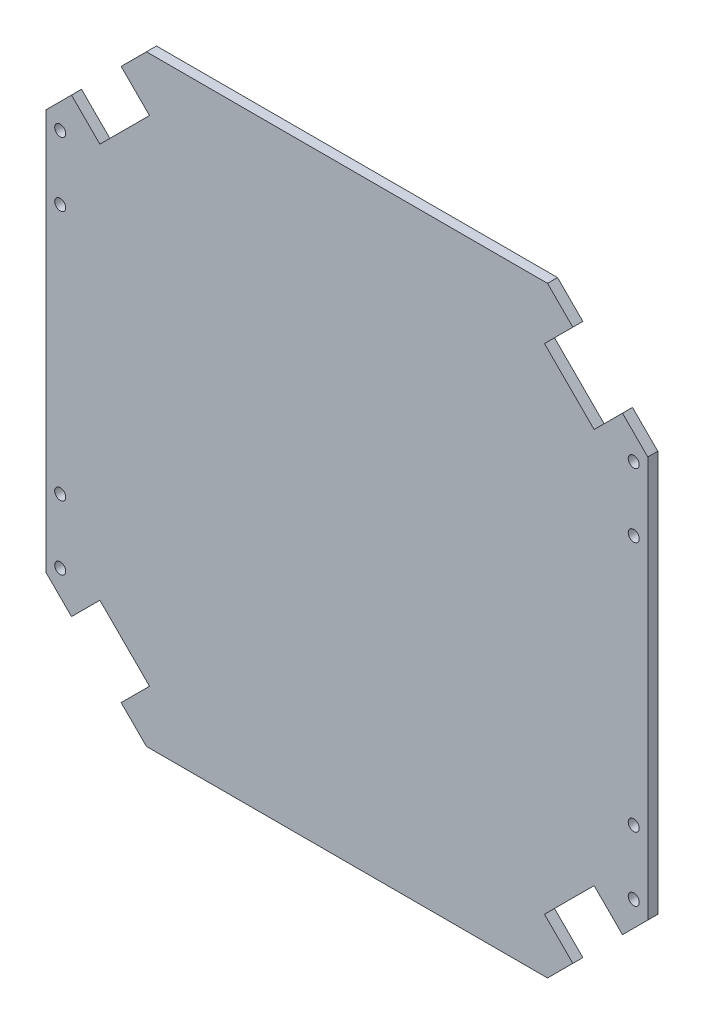
from build123d import *

# Parameters (mm, degrees)
BOSS_EXTRU_1_DEPTH      = 5
ESQUISSE2_R             = 2.75
ENL_V_MAT_EXTRU_1_DEPTH = 213.190951739


with BuildPart() as part:
    # Esquisse1 → Boss.-Extru.1 (new body)
    with BuildSketch(Plane.XY):
        Polygon((112.625631329, 137.374368671), (100, 150), (-100, 150), (-112.625631329, 137.374368671), (-98.483495706, 123.232233047), (-123.232233047, 98.483495706), (-137.374368671, 112.625631329), (-150, 100), (-150, -100), (-137.374368671, -112.625631329), (-123.232233047, -98.483495706), (-98.483495706, -123.232233047), (-112.625631329, -137.374368671), (-100, -150), (100, -150), (112.625631329, -137.374368671), (98.483495706, -123.232233047), (123.232233047, -98.483495706), (137.374368671, -112.625631329), (150, -100), (150, 100), (137.374368671, 112.625631329), (123.232233047, 98.483495706), (98.483495706, 123.232233047), align=None)
    extrude(amount=BOSS_EXTRU_1_DEPTH)

    # Esquisse2 → Enlèv. mat.-Extru.1 (cut, through all)
    with BuildSketch(Plane(origin=(0, 0, 0), x_dir=(-1, 0, 0), z_dir=(0, 0, -1))):
        with Locations((143, -62.5)):
            Circle(ESQUISSE2_R)
        with Locations((143, -94.5)):
            Circle(ESQUISSE2_R)
        with Locations((143, 62.5)):
            Circle(ESQUISSE2_R)
        with Locations((143, 94.5)):
            Circle(ESQUISSE2_R)
        with Locations((-143, -62.5)):
            Circle(ESQUISSE2_R)
        with Locations((-143, -94.5)):
            Circle(ESQUISSE2_R)
        with Locations((-143, 62.5)):
            Circle(ESQUISSE2_R)
        with Locations((-143, 94.5)):
            Circle(ESQUISSE2_R)
    extrude(amount=-ENL_V_MAT_EXTRU_1_DEPTH, mode=Mode.SUBTRACT)


solid = part.part
